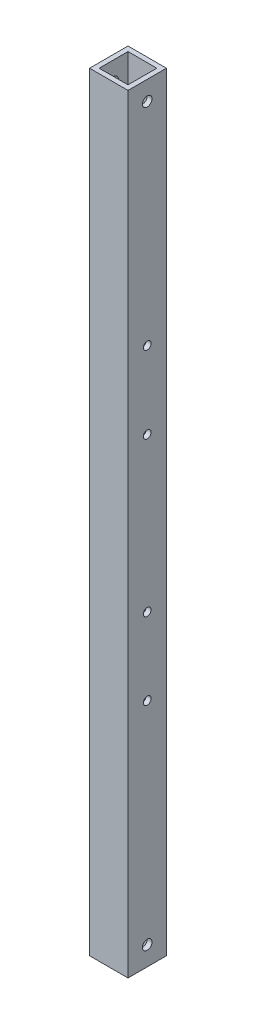
from build123d import *

# Parameters (mm, degrees)
SKETCH1_W           = 25.4
SKETCH1_H           = 25.4
SKETCH1_W_2         = 19.05
SKETCH1_H_2         = 19.05
BOSS_EXTRUDE1_DEPTH = 508
SKETCH2_R           = 3.175
CUT_EXTRUDE1_DEPTH  = 510.268416456
CUT_EXTRUDE2_REACH  = 511.268
SKETCH3_R           = 2.5796875


with BuildPart() as part:
    # Sketch1 → Boss-Extrude1 (new body)
    with BuildSketch(Plane(origin=(0, 0, 0), x_dir=(1, 0, 0), z_dir=(0, 1, 0))):
        with Locations((12.7, 12.7)):
            Rectangle(SKETCH1_W, SKETCH1_H)
        with Locations((12.7, 12.7)):
            Rectangle(SKETCH1_W_2, SKETCH1_H_2, mode=Mode.SUBTRACT)
    extrude(amount=BOSS_EXTRUDE1_DEPTH)

    # Sketch2 → Cut-Extrude1 (cut, through all)
    with BuildSketch(Plane(origin=(25.4, 0, 0), x_dir=(0, 0, -1), z_dir=(1, 0, 0))):
        with Locations((12.7, 12.7)):
            Circle(SKETCH2_R)
    cut_extrude1 = extrude(amount=-CUT_EXTRUDE1_DEPTH, mode=Mode.SUBTRACT)

    # Mirror1: Cut-Extrude1 across plane
    add(cut_extrude1.mirror(Plane.ZX.offset(254)), mode=Mode.SUBTRACT)

    # Sketch3 → Cut-Extrude2 (cut, up to next)
    with BuildSketch(Plane(origin=(25.4, 0, 0), x_dir=(0, 0, -1), z_dir=(1, 0, 0)), mode=Mode.PRIVATE) as cut_extrude2_sk1:
        with Locations((12.7, 304.800000001)):
            Circle(SKETCH3_R)
    cut_extrude2_tool1 = extrude(cut_extrude2_sk1.sketch, amount=-CUT_EXTRUDE2_REACH, mode=Mode.PRIVATE) & part.part
    # Sketch3 → Cut-Extrude2 (cut, up to next)
    with BuildSketch(Plane(origin=(25.4, 0, 0), x_dir=(0, 0, -1), z_dir=(1, 0, 0)), mode=Mode.PRIVATE) as cut_extrude2_sk2:
        with Locations((12.7, 355.600000001)):
            Circle(SKETCH3_R)
    cut_extrude2_tool2 = extrude(cut_extrude2_sk2.sketch, amount=-CUT_EXTRUDE2_REACH, mode=Mode.PRIVATE) & part.part
    # Sketch3 → Cut-Extrude2 (cut, up to next)
    with BuildSketch(Plane(origin=(25.4, 0, 0), x_dir=(0, 0, -1), z_dir=(1, 0, 0)), mode=Mode.PRIVATE) as cut_extrude2_sk3:
        with Locations((12.7, 203.200000001)):
            Circle(SKETCH3_R)
    cut_extrude2_tool3 = extrude(cut_extrude2_sk3.sketch, amount=-CUT_EXTRUDE2_REACH, mode=Mode.PRIVATE) & part.part
    # Sketch3 → Cut-Extrude2 (cut, up to next)
    with BuildSketch(Plane(origin=(25.4, 0, 0), x_dir=(0, 0, -1), z_dir=(1, 0, 0)), mode=Mode.PRIVATE) as cut_extrude2_sk4:
        with Locations((12.7, 152.400000001)):
            Circle(SKETCH3_R)
    cut_extrude2_tool4 = extrude(cut_extrude2_sk4.sketch, amount=-CUT_EXTRUDE2_REACH, mode=Mode.PRIVATE) & part.part
    add(cut_extrude2_tool1.solids().sort_by_distance((25.4, 304.8, -12.7))[0], mode=Mode.SUBTRACT)
    add(cut_extrude2_tool2.solids().sort_by_distance((25.4, 355.6, -12.7))[0], mode=Mode.SUBTRACT)
    add(cut_extrude2_tool3.solids().sort_by_distance((25.4, 203.2, -12.7))[0], mode=Mode.SUBTRACT)
    add(cut_extrude2_tool4.solids().sort_by_distance((25.4, 152.4, -12.7))[0], mode=Mode.SUBTRACT)


solid = part.part
